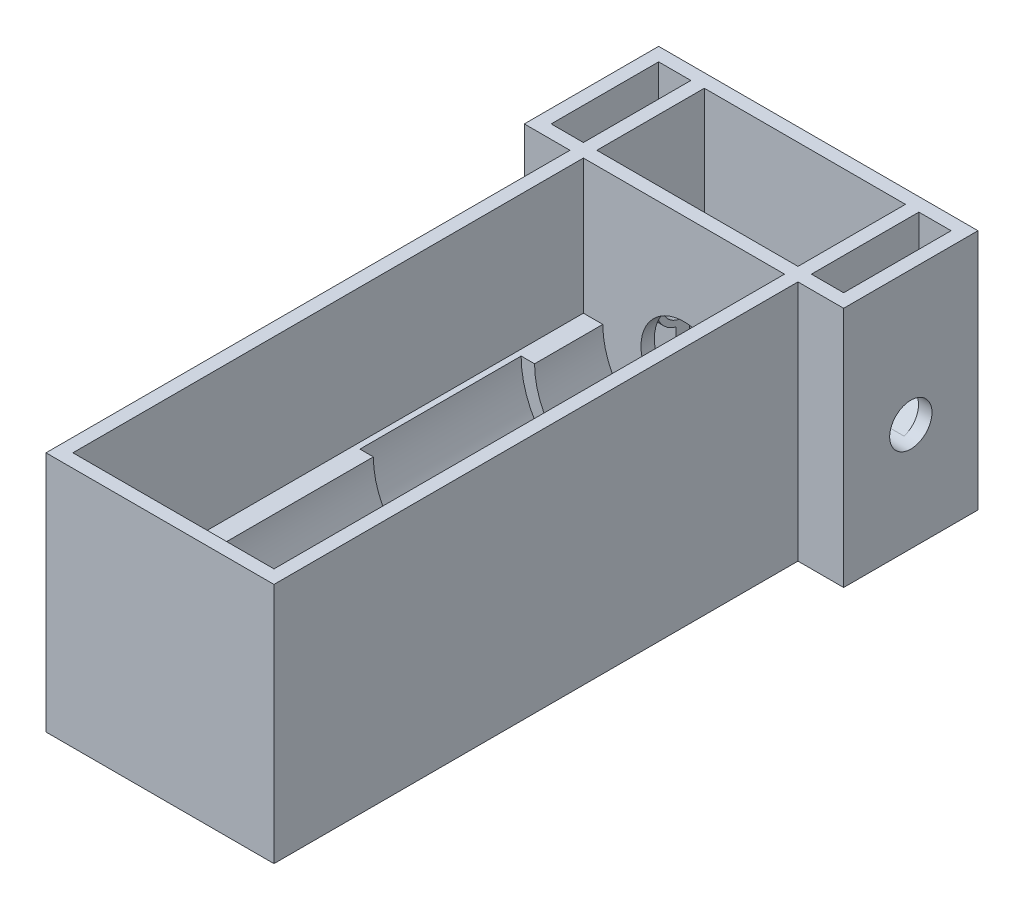
from build123d import *

# Parameters (mm, degrees)
BOSS_EXTRUDE1_DEPTH      = 12.7
SKETCH2_W                = 53.879496
SKETCH2_H                = 57.15
BOSS_EXTRUDE2_DEPTH      = 3.175
CUT_EXTRUDE2_DEPTH       = 66.145131417
CUT_EXTRUDE2_DEPTH_BACK  = 66.145131417
SKETCH3_R                = 5
SKETCH5_W                = 53.879496
SKETCH5_H                = 25.4
SKETCH5_R                = 3.4925
BOSS_EXTRUDE3_DEPTH      = 6.35
SKETCH7_W                = 7.62
SKETCH7_H                = 15.609396712
BOSS_EXTRUDE7_DEPTH      = 1.5875
SKETCH8_W                = 53.879496
SKETCH8_H                = 57.15
BOSS_EXTRUDE8_DEPTH      = 127
CUT_EXTRUDE7_DEPTH       = 154.323065852
CUT_EXTRUDE7_DEPTH_BACK  = 154.323065852
SKETCH13_W               = 0.002356984
SKETCH13_H               = 124.229061331
CUT_EXTRUDE8_START       = -31.75
SKETCH14_W               = 47.527139016
SKETCH14_H               = 120.65
CUT_EXTRUDE8_DEPTH       = 31.75
CUT_EXTRUDE9_DEPTH       = 4.229066359
SKETCH16_W               = 53.879496
SKETCH16_H               = 25.4
CUT_EXTRUDE10_DEPTH      = 152.071109158
SKETCH18_W               = 13.97
SKETCH18_H               = 31.75
SKETCH18_W_2             = 7.62
SKETCH18_H_2             = 25.4
BOSS_EXTRUDE10_DEPTH     = 57.15
BOSS_EXTRUDE11_START     = -34.559748
BOSS_EXTRUDE11_DEPTH     = 7.62
BOSS_EXTRUDE12_START     = 26.939748
BOSS_EXTRUDE12_DEPTH     = 7.62
CUT_EXTRUDE11_DEPTH      = 163.985890519
CUT_EXTRUDE11_DEPTH_BACK = 163.985890519
SKETCH20_R               = 5


with BuildPart() as part:
    # Sketch1 → Boss-Extrude1 (new, symmetric)
    with BuildSketch(Plane.XY):
        Polygon((-26.939748, 0), (26.939748, 0), (26.939748, 6.35), (26.939748, 57.15), (23.764748, 57.15), (23.764748, 6.35), (-23.764748, 6.35), (-23.764748, 57.15), (-26.939748, 57.15), (-26.939748, 6.35), align=None)
    extrude(amount=BOSS_EXTRUDE1_DEPTH, both=True)

    # Sketch2 → Boss-Extrude2 (add)
    with BuildSketch(Plane(origin=(0, 0, -12.7), x_dir=(-1, 0, 0), z_dir=(0, 0, -1))):
        with Locations((0, 28.575)):
            Rectangle(SKETCH2_W, SKETCH2_H)
    extrude(amount=BOSS_EXTRUDE2_DEPTH)

    # Sketch6 → Revolve2 (revolve)
    with BuildSketch(Plane.XY, mode=Mode.PRIVATE) as revolve2_sk:
        Polygon((-23.764748, 25.4), (-16.144748, 25.4), (-16.144748, 31.75), (-21.224748, 31.75), (-23.764748, 33.02), align=None)
        Polygon((23.764748, 33.02), (23.764748, 25.4), (16.144748, 25.4), (16.144748, 31.75), (21.224748, 31.75), align=None)
    revolve(revolve2_sk.sketch.rotate(Axis((-23.764748, 25.4, 0), (1, 0, 0)), 90), axis=Axis((-23.764748, 25.4, 0), (1, 0, 0)))

    # Sketch3 → Cut-Extrude2 (cut, two sides: drawn at the far end of the back side and taken through both)
    with BuildSketch(Plane(origin=(0, 0, 0), x_dir=(0, 0, -1), z_dir=(1, 0, 0)).offset(-CUT_EXTRUDE2_DEPTH_BACK)):
        with Locations((0, 25.4)):
            Circle(SKETCH3_R)
    extrude(amount=CUT_EXTRUDE2_DEPTH + CUT_EXTRUDE2_DEPTH_BACK, mode=Mode.SUBTRACT)

    # Sketch5 → Boss-Extrude3 (add)
    with BuildSketch(Plane.XZ):
        with Locations((0, -28.575)):
            Rectangle(SKETCH5_W, SKETCH5_H)
        with Locations(Location((7.889748, -28.575, 0), (0, 0, 270))):
            Circle(SKETCH5_R, mode=Mode.SUBTRACT)
        with Locations(Location((-17.510252, -28.575, 0), (0, 0, 270))):
            Circle(SKETCH5_R, mode=Mode.SUBTRACT)
    extrude(amount=-BOSS_EXTRUDE3_DEPTH)

    # Sketch7 → Boss-Extrude7 (add, symmetric)
    with BuildSketch(Plane.XY):
        with Locations((-19.954748, 14.154698356)):
            Rectangle(SKETCH7_W, SKETCH7_H)
        with Locations((19.954748, 14.154698356)):
            Rectangle(SKETCH7_W, SKETCH7_H)
    extrude(amount=BOSS_EXTRUDE7_DEPTH, both=True)

    # Sketch8 → Boss-Extrude8 (add)
    with BuildSketch(Plane.XY.offset(12.7)):
        with Locations((0, 28.575)):
            Rectangle(SKETCH8_W, SKETCH8_H)
    extrude(amount=BOSS_EXTRUDE8_DEPTH)

    # Sketch9 → Cut-Revolve1 (revolve, cut)
    with BuildSketch(Plane(origin=(0, 0, 0), x_dir=(0, 0, -1), z_dir=(1, 0, 0))):
        Polygon((-70.104, 47.752), (-70.104, 44.577), (-136.525, 44.577), (-136.525, 25.4), (-70.104, 25.4), (0, 25.4), (0, 35.56), (-20.104066359, 35.56), (-20.104066359, 44.577), (-32.004, 44.577), (-32.004, 47.752), align=None)
    revolve(axis=Axis((0, 25.4, 0), (0, 0, 1)), mode=Mode.SUBTRACT)

    # Sketch13 → Cut-Extrude7 (cut, two sides: drawn at the far end of the back side and taken through both)
    with BuildSketch(Plane(origin=(0, 0, 0), x_dir=(-1, 0, 0), z_dir=(0, -1, 0)).offset(-CUT_EXTRUDE7_DEPTH_BACK)):
        with Locations((26.940926492, -77.585469335)):
            Rectangle(SKETCH13_W, SKETCH13_H)
        with Locations((-26.938569508, -77.585469335)):
            Rectangle(SKETCH13_W, SKETCH13_H)
    extrude(amount=CUT_EXTRUDE7_DEPTH + CUT_EXTRUDE7_DEPTH_BACK, mode=Mode.SUBTRACT)

    # Sketch14 → Cut-Extrude8 (cut)
    with BuildSketch(Plane(origin=(0, 57.15, 0), x_dir=(1, 0, 0), z_dir=(0, 1, 0)).offset(CUT_EXTRUDE8_START)):
        with Locations((-0.001178492, -76.2)):
            Rectangle(SKETCH14_W, SKETCH14_H)
    extrude(amount=CUT_EXTRUDE8_DEPTH, mode=Mode.SUBTRACT)

    # Sketch15 → Cut-Extrude9 (cut)
    with BuildSketch(Plane.XY.offset(20.104066359)):
        with BuildLine():
            Line((-10.16, 25.4), (-19.177, 25.4))
            ThreePointArc((-19.177, 25.4), (0, 6.223), (19.177, 25.4))
            Line((19.177, 25.4), (10.16, 25.4))
            ThreePointArc((10.16, 25.4), (0, 15.24), (-10.16, 25.4))
        make_face()
    extrude(amount=-CUT_EXTRUDE9_DEPTH, mode=Mode.SUBTRACT)

    # Sketch16 → Cut-Extrude10 (cut, through all)
    with BuildSketch(Plane(origin=(0, 6.35, 0), x_dir=(1, 0, 0), z_dir=(0, 1, 0))):
        with Locations((0, 28.575)):
            Rectangle(SKETCH16_W, SKETCH16_H)
    extrude(amount=-CUT_EXTRUDE10_DEPTH, mode=Mode.SUBTRACT)

    # Sketch18 → Boss-Extrude10 (add)
    with BuildSketch(Plane(origin=(0, 0, 0), x_dir=(1, 0, 0), z_dir=(0, 1, 0))):
        with Locations((-30.749748, 0)):
            Rectangle(SKETCH18_W, SKETCH18_H)
        with Locations((-30.749748, 0)):
            Rectangle(SKETCH18_W_2, SKETCH18_H_2, mode=Mode.SUBTRACT)
    boss_extrude10 = extrude(amount=BOSS_EXTRUDE10_DEPTH)

    # Sketch19 → Boss-Extrude11 (add)
    with BuildSketch(Plane(origin=(0, 0, 0), x_dir=(0, 0, -1), z_dir=(1, 0, 0)).offset(BOSS_EXTRUDE11_START)):
        with BuildLine():
            Line((1.5875, 20.658708641), (12.7, 24.379444705))
            Line((12.7, 24.379444705), (12.7, 0))
            Line((12.7, 0), (-12.7, 0))
            Line((-12.7, 0), (-12.7, 24.379444705))
            Line((-12.7, 24.379444705), (-1.5875, 20.658708641))
            ThreePointArc((-1.5875, 20.658708641), (0, 20.4), (1.5875, 20.658708641))
        make_face()
    extrude(amount=BOSS_EXTRUDE11_DEPTH)

    # Mirror4: Boss-Extrude10 across plane
    add(boss_extrude10.mirror(Plane(origin=(0, 0, 0), x_dir=(0, 0, 1), z_dir=(1, 0, 0))))

    # Sketch19<2> → Boss-Extrude12 (add)
    with BuildSketch(Plane(origin=(0, 0, 0), x_dir=(0, 0, -1), z_dir=(1, 0, 0)).offset(BOSS_EXTRUDE12_START)):
        with BuildLine():
            Line((1.5875, 20.658708641), (12.7, 24.379444705))
            Line((12.7, 24.379444705), (12.7, 0))
            Line((12.7, 0), (-12.7, 0))
            Line((-12.7, 0), (-12.7, 24.379444705))
            Line((-12.7, 24.379444705), (-1.5875, 20.658708641))
            ThreePointArc((-1.5875, 20.658708641), (0, 20.4), (1.5875, 20.658708641))
        make_face()
    extrude(amount=BOSS_EXTRUDE12_DEPTH)

    # Sketch20 → Cut-Extrude11 (cut, two sides: drawn at the far end of the back side and taken through both)
    with BuildSketch(Plane(origin=(-23.764748, 0, 0), x_dir=(0, 0, -1), z_dir=(1, 0, 0)).offset(-CUT_EXTRUDE11_DEPTH_BACK)):
        with Locations((0, 25.4)):
            Circle(SKETCH20_R)
    extrude(amount=CUT_EXTRUDE11_DEPTH + CUT_EXTRUDE11_DEPTH_BACK, mode=Mode.SUBTRACT)


solid = part.part
